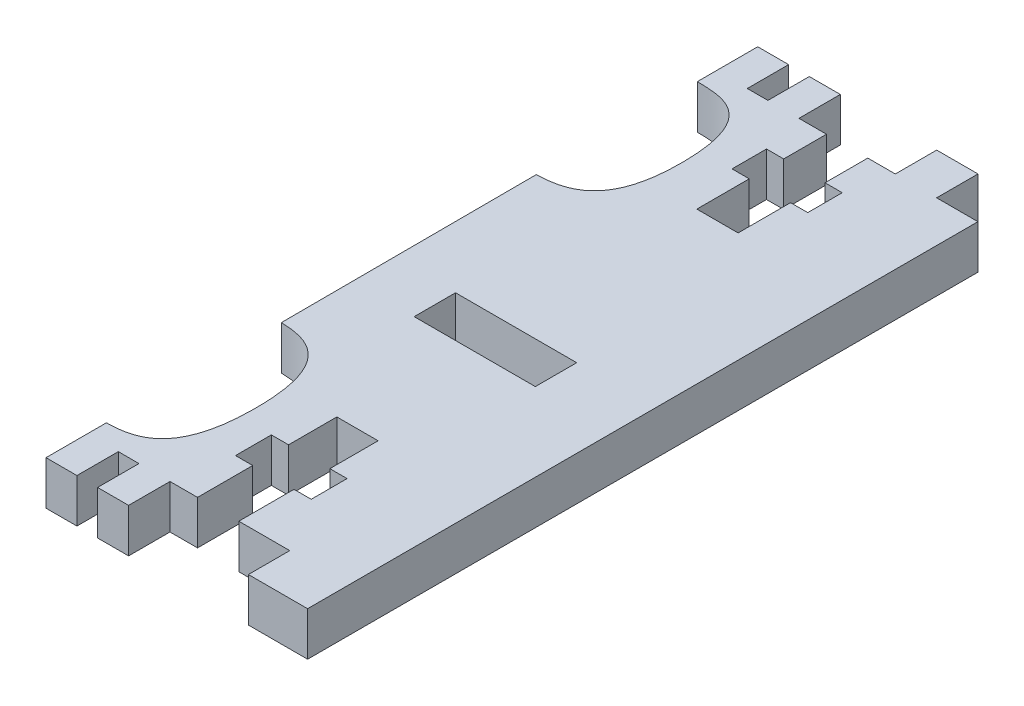
from build123d import *

# Parameters (mm, degrees)
SKETCH1_W           = 8.784371834
SKETCH1_H           = 3.000075643
BOSS_EXTRUDE1_DEPTH = 3.175


with BuildPart() as part:
    # Sketch1 → Boss-Extrude1 (new body)
    with BuildSketch(Plane(origin=(0, 0, 0), x_dir=(1, 0, 0), z_dir=(0, 1, 0))):
        with BuildLine():
            Line((-9.483120155, -21.470892841), (-9.483120155, -25.850971148))
            Line((-9.483120155, -25.850971148), (-7.240182549, -25.850971148))
            Line((-7.240182549, -25.850971148), (-7.240182549, -22.850827141))
            Line((-7.240182549, -22.850827141), (-5.742820851, -22.850827141))
            Line((-5.742820851, -22.850827141), (-5.742820851, -25.850971148))
            Line((-5.742820851, -25.850971148), (-3.493751351, -25.850971148))
            Line((-3.493751351, -25.850971148), (-3.493751351, -22.850827141))
            Line((-3.493751351, -22.850827141), (-1.497298333, -22.850827141))
            Line((-1.497298333, -22.850827141), (-1.497298333, -18.850679894))
            Line((-1.497298333, -18.850679894), (-2.745036382, -18.850679894))
            Line((-2.745036382, -18.850679894), (-2.745036382, -18.750702276))
            Line((-2.745036382, -18.750702276), (-2.745036382, -16.250563552))
            Line((-2.745036382, -16.250563552), (-1.497298333, -16.250563552))
            Line((-1.497298333, -16.250563552), (-1.497298333, -12.750414262))
            Line((-1.497298333, -12.750414262), (1.49723009, -12.750414262))
            Line((1.49723009, -12.750414262), (1.49723009, -16.250563552))
            Line((1.49723009, -16.250563552), (2.745046129, -16.250563552))
            Line((2.745046129, -16.250563552), (2.745046129, -18.750702276))
            Line((2.745046129, -18.750702276), (2.745046129, -18.850679894))
            Line((2.745046129, -18.850679894), (1.49723009, -18.850679894))
            Line((1.49723009, -18.850679894), (1.49723009, -22.850827141))
            Line((1.49723009, -22.850827141), (5.190823665, -22.850827141))
            Line((5.190823665, -22.850827141), (5.190823665, -25.850971148))
            Line((5.190823665, -25.850971148), (9.483120155, -25.850971148))
            Line((9.483120155, -25.850971148), (9.483120155, 22.750856849))
            Line((9.483120155, 22.750856849), (6.488406507, 22.750856849))
            Line((6.488406507, 22.750856849), (6.488406507, 25.750995973))
            Line((6.488406507, 25.750995973), (3.49369286, 25.750995973))
            Line((3.49369286, 25.750995973), (3.49369286, 22.750856849))
            Line((3.49369286, 22.750856849), (1.497230093, 22.750856849))
            Line((1.497230093, 22.750856849), (1.497230093, 19.650735225))
            Line((1.497230093, 19.650735225), (2.745046131, 19.650735225))
            Line((2.745046131, 19.650735225), (2.745046131, 17.150659981))
            Line((2.745046131, 17.150659981), (1.497230093, 17.150659981))
            Line((1.497230093, 17.150659981), (1.497230093, 13.350397163))
            Line((1.497230093, 13.350397163), (-1.497298331, 13.350397163))
            Line((-1.497298331, 13.350397163), (-1.497298331, 17.150659981))
            Line((-1.497298331, 17.150659981), (-2.74503638, 17.150659981))
            Line((-2.74503638, 17.150659981), (-2.74503638, 19.650735225))
            Line((-2.74503638, 19.650735225), (-1.497298331, 19.650735225))
            Line((-1.497298331, 19.650735225), (-1.497298331, 22.750856849))
            Line((-1.497298331, 22.750856849), (-3.493751349, 22.750856849))
            Line((-3.493751349, 22.750856849), (-3.493751349, 25.750995973))
            Line((-3.493751349, 25.750995973), (-5.742820849, 25.750995973))
            Line((-5.742820849, 25.750995973), (-5.742820849, 22.750856849))
            Line((-5.742820849, 22.750856849), (-7.240182547, 22.750856849))
            Line((-7.240182547, 22.750856849), (-7.240182547, 25.750995973))
            Line((-7.240182547, 25.750995973), (-9.483120153, 25.750995973))
            Line((-9.483120153, 25.750995973), (-9.483120153, 21.370917666))
            add(Edge.make_bspline(
                [(-4.952518186, 15.886251248), (-5.015201934, 21.274211759), (-7.426547278, 21.343845481), (-9.483120153, 21.370917666)],
                knots=[6, 6, 6, 6, 7, 7, 7, 7], degree=3))
            add(Edge.make_bspline(
                [(-9.483120153, 9.692990904), (-7.240182547, 9.757380123), (-4.889844186, 10.498168659), (-4.952518186, 15.886251248)],
                knots=[5, 5, 5, 5, 6, 6, 6, 6], degree=3))
            Line((-9.483120153, 9.692990904), (-9.431179406, -8.834115587))
            add(Edge.make_bspline(
                [(-9.431179406, -8.834115587), (-7.188183308, -8.898499923), (-4.965366893, -9.64325846), (-4.995070997, -15.262909799)],
                knots=[1, 1, 1, 1, 2, 2, 2, 2], degree=3))
            add(Edge.make_bspline(
                [(-4.995070997, -15.262909799), (-5.024784848, -20.882307214), (-7.42654728, -21.443818214), (-9.483120155, -21.470892841)],
                knots=[2, 2, 2, 2, 3, 3, 3, 3], degree=3))
        make_face()
        with Locations((-0.598927132, -2.150035167)):
            Rectangle(SKETCH1_W, SKETCH1_H, mode=Mode.SUBTRACT)
    extrude(amount=BOSS_EXTRUDE1_DEPTH)


solid = part.part
